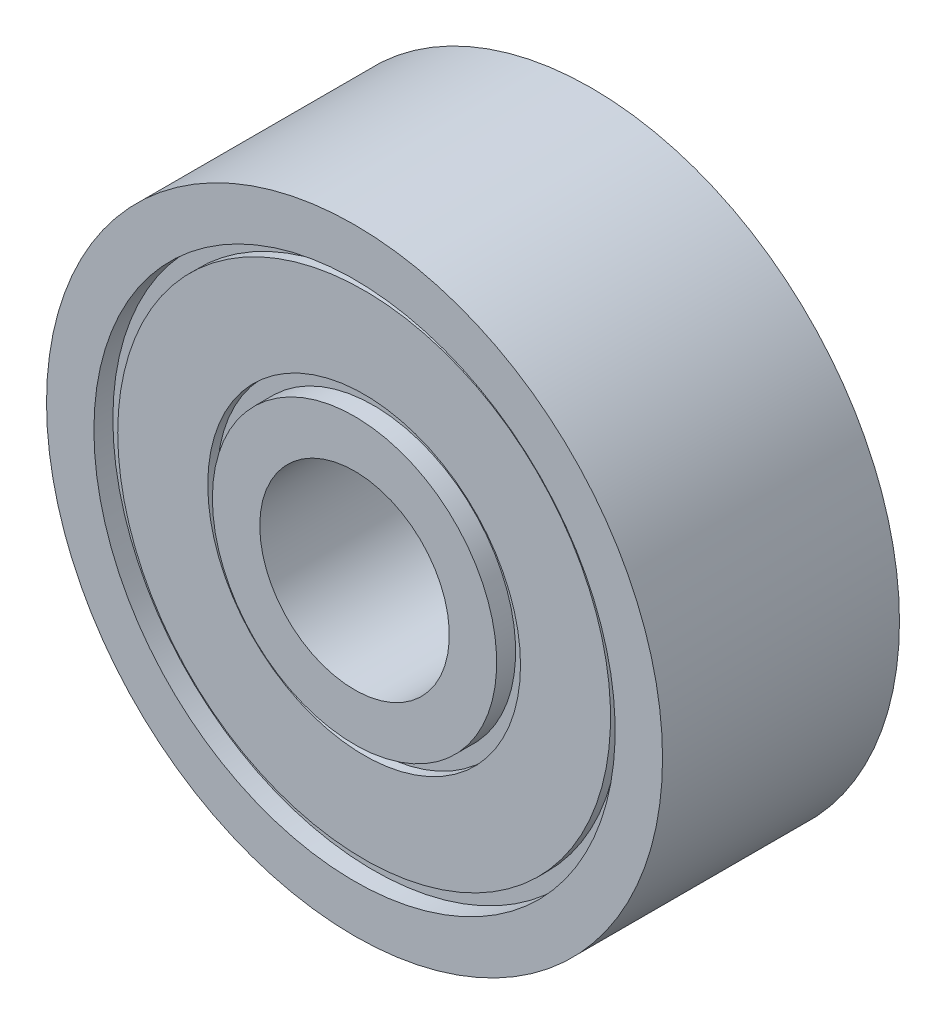
from build123d import *

# Parameters (mm, degrees)
SKETCH1_R           = 6.4999997
SKETCH1_R_2         = 1.999996
BOSS_EXTRUDE1_DEPTH = 4.99999


with BuildPart() as part:
    # Sketch1 → Boss-Extrude1 (new body)
    with BuildSketch(Plane.XY.offset(7)):
        with Locations(Location((0, 0, 0), (0, 0, 180))):
            Circle(SKETCH1_R)
        with Locations(Location((0, 0, 0), (0, 0, 180))):
            Circle(SKETCH1_R_2, mode=Mode.SUBTRACT)
    extrude(amount=-BOSS_EXTRUDE1_DEPTH)

    # Sketch4 → Cut-Revolve1 (revolve, cut)
    with BuildSketch(Plane(origin=(0, 0, 0), x_dir=(1, 0, 0), z_dir=(0, 1, 0)), mode=Mode.PRIVATE) as cut_revolve1_sk:
        Polygon((2.99999654, -2.4000092), (2.99999654, -2.00001), (5.49999916, -2.00001), (5.49999916, -2.4000092), (5.19999976, -2.4000092), (5.19999976, -2.202656618), (3.29999594, -2.202656618), (3.29999594, -2.4000092), align=None)
        Polygon((5.49999916, -7), (2.99999654, -7), (2.99999654, -6.6000008), (3.29999594, -6.6000008), (3.29999594, -6.797353382), (5.19999976, -6.797353382), (5.19999976, -6.6000008), (5.49999916, -6.6000008), align=None)
    revolve(cut_revolve1_sk.sketch.rotate(Axis((0, 0, 2.00001), (0, 0, 1)), 180), axis=Axis((0, 0, 2.00001), (0, 0, 1)), mode=Mode.SUBTRACT)


solid = part.part
